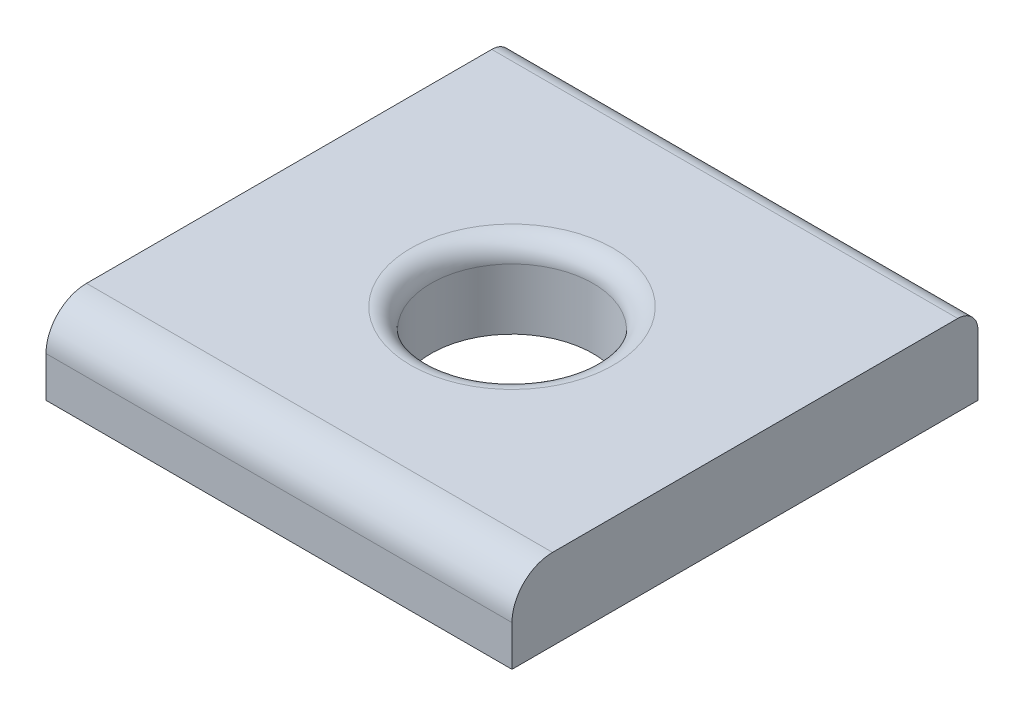
from build123d import *

# Parameters (mm, degrees)
SKETCH1_W           = 11.5
SKETCH1_H           = 11.5
BOSS_EXTRUDE1_DEPTH = 2
SKETCH2_R           = 2
CUT_EXTRUDE1_DEPTH  = 9.374067112
FILLET1_R           = 1
FILLET2_R           = 0.5
FILLET3_R           = 0.5


with BuildPart() as part:
    # Sketch1 → Boss-Extrude1 (new body)
    with BuildSketch(Plane(origin=(0, 0, 0), x_dir=(1, 0, 0), z_dir=(0, 1, 0))):
        Rectangle(SKETCH1_W, SKETCH1_H)
    extrude(amount=BOSS_EXTRUDE1_DEPTH)

    # Sketch2 → Cut-Extrude1 (cut, through all)
    with BuildSketch(Plane(origin=(0, 2, 0), x_dir=(1, 0, 0), z_dir=(0, 1, 0))):
        with Locations(Location((0, 0, 0), (0, 0, 270))):
            Circle(SKETCH2_R)
    extrude(amount=-CUT_EXTRUDE1_DEPTH, mode=Mode.SUBTRACT)

    # Fillet1
    fillet1_edges = [part.edges().sort_by_distance(p)[0] for p in [
        (0, 2, 5.75),
    ]]
    fillet(fillet1_edges, radius=FILLET1_R)

    # Fillet2
    fillet2_edges = [part.edges().sort_by_distance(p)[0] for p in [
        (0, 2, -5.75),
    ]]
    fillet(fillet2_edges, radius=FILLET2_R)

    # Fillet3
    fillet3_edges = [part.edges().sort_by_distance(p)[0] for p in [
        (0, 2, -2),
    ]]
    fillet(fillet3_edges, radius=FILLET3_R)


solid = part.part
